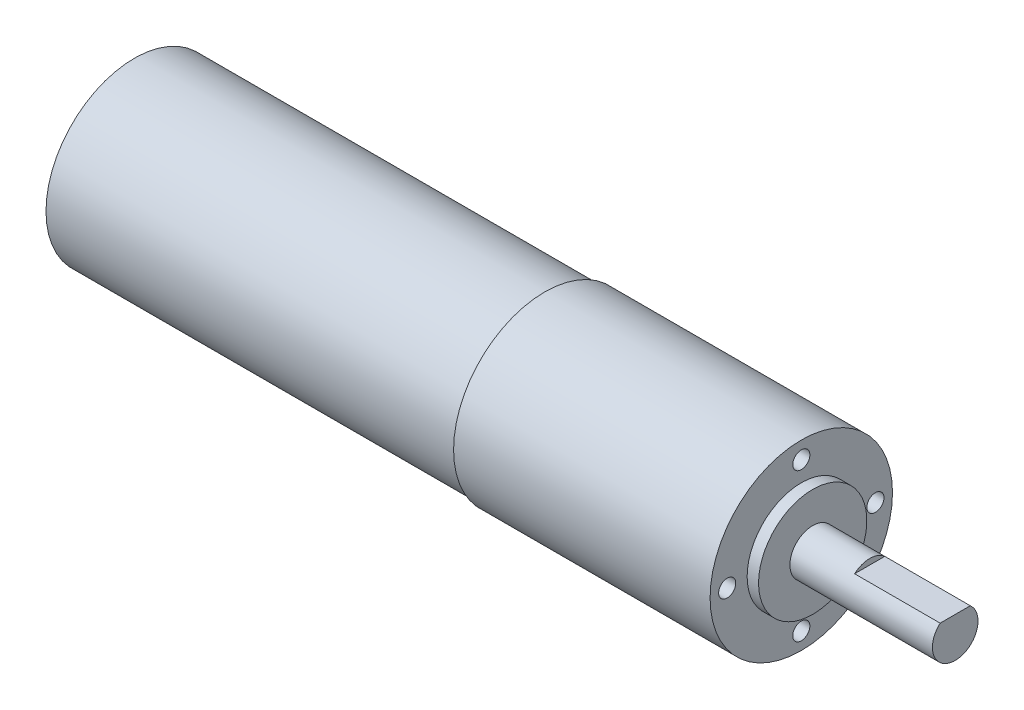
from build123d import *

# Parameters (mm, degrees)
CUT_EXTRUDE1_DEPTH = 15
SKETCH3_R          = 1.5
CUT_EXTRUDE2_DEPTH = 5


with BuildPart() as part:
    # Sketch1 → Revolve1 (revolve)
    with BuildSketch(Plane.XY, mode=Mode.PRIVATE) as revolve1_sk:
        Polygon((0, 0), (0, 15.5), (72, 15.5), (72, 16), (117, 16), (117, 9.5), (119, 9.5), (119, 4), (144, 4), (144, 0), align=None)
    revolve(revolve1_sk.sketch.rotate(Axis((0, 0, 0), (1, 0, 0)), 90), axis=Axis((0, 0, 0), (1, 0, 0)))

    # Sketch2 → Cut-Extrude1 (cut)
    with BuildSketch(Plane(origin=(144, 0, 0), x_dir=(0, 0, -1), z_dir=(1, 0, 0))):
        with BuildLine():
            Line((-2.645751311, 3), (2.645751311, 3))
            ThreePointArc((2.645751311, 3), (0, 4), (-2.645751311, 3))
        make_face()
    extrude(amount=-CUT_EXTRUDE1_DEPTH, mode=Mode.SUBTRACT)

    # Sketch3 → Cut-Extrude2 (cut)
    with BuildSketch(Plane(origin=(117, 0, 0), x_dir=(0, 0, -1), z_dir=(1, 0, 0))):
        with Locations((0, 13)):
            Circle(SKETCH3_R)
        with Locations((13, 0)):
            Circle(SKETCH3_R)
        with Locations((0, -13)):
            Circle(SKETCH3_R)
        with Locations((-13, 0)):
            Circle(SKETCH3_R)
    extrude(amount=-CUT_EXTRUDE2_DEPTH, mode=Mode.SUBTRACT)


solid = part.part
